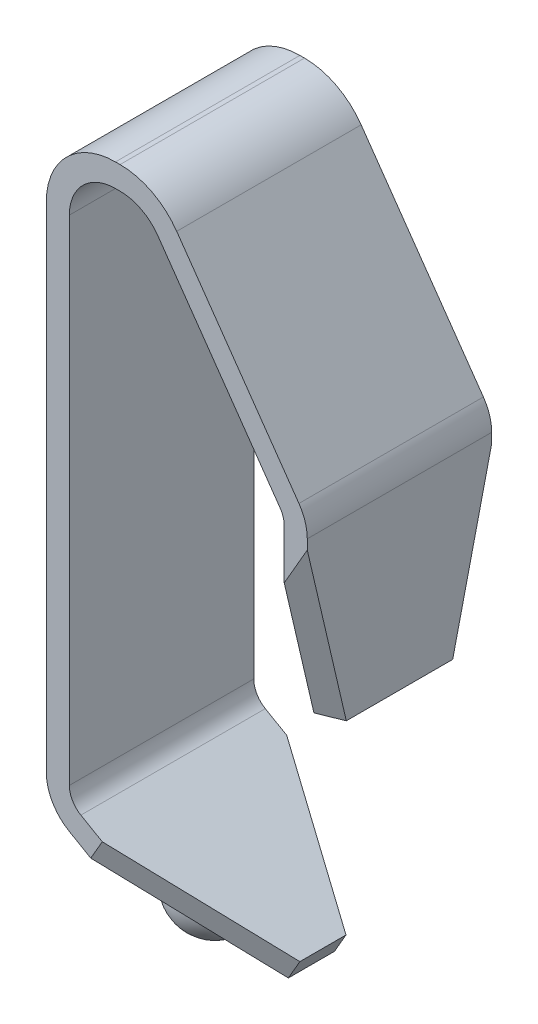
from build123d import *

# Parameters (mm, degrees)
EXTRUDE_THIN1_DEPTH     = 2
CUT_EXTRUDE1_DEPTH      = 14.670442165
CUT_EXTRUDE1_DEPTH_BACK = 14.670442165


with BuildPart() as part:
    # Sketch1 → Extrude-Thin1 (new, symmetric)
    with BuildSketch(Plane.XY):
        with BuildLine():
            Line((3.5, -2.020725942), (0.25, -0.144337567))
            ThreePointArc((0.25, -0.144337567), (0.066987298, 0.038675135), (0, 0.288675135))
            Line((0, 0.288675135), (0, 11))
            ThreePointArc((0, 11), (0.292893219, 11.707106781), (1, 12))
            Line((1, 12), (1.1, 12))
            ThreePointArc((1.1, 12), (1.561748613, 11.887010833), (1.919152044, 11.573576436))
            Line((1.919152044, 11.573576436), (4.570098185, 7.787632989))
            ThreePointArc((4.570098185, 7.787632989), (4.637380639, 7.651197671), (4.660522163, 7.500844771))
            Line((4.660522163, 7.500844771), (4.660522163, 3.658494165))
            Line((4.660522163, 3.658494165), (5.160522163, 3.658494165))
            Line((5.160522163, 3.658494165), (5.160522163, 7.500844771))
            ThreePointArc((5.160522163, 7.500844771), (5.114239114, 7.80155057), (4.979674208, 8.074421207))
            Line((4.979674208, 8.074421207), (2.328728066, 11.860364655))
            ThreePointArc((2.328728066, 11.860364655), (1.79262292, 12.33051625), (1.1, 12.5))
            Line((1.1, 12.5), (1, 12.5))
            ThreePointArc((1, 12.5), (-0.060660172, 12.060660172), (-0.5, 11))
            Line((-0.5, 11), (-0.5, 0.288675135))
            ThreePointArc((-0.5, 0.288675135), (-0.366025404, -0.211324865), (0, -0.577350269))
            Line((0, -0.577350269), (3.25, -2.453738644))
            Line((3.25, -2.453738644), (3.5, -2.020725942))
        make_face()
    extrude(amount=EXTRUDE_THIN1_DEPTH, both=True)

    # Sketch3 → Cut-Extrude1 (cut, two sides: drawn at the far end of the back side and taken through both)
    with BuildSketch(Plane(origin=(0, 0, 0), x_dir=(0.8660254037844364, -0.500000000000004, 0), z_dir=(0.500000000000004, 0.8660254037844364, 0)).offset(-CUT_EXTRUDE1_DEPTH_BACK)):
        Polygon((33.065052182, 13.033927086), (4.041451884, -0.5), (0.824691504, -2), (0.824691504, -2.582001287), (5.059767422, -2.582001287), (5.059767422, 2.96154049), (0.824691504, 2.96154049), (0.824691504, 2), (4.041451884, 0.5), (33.065052182, -13.033927086), (97.113051575, -13.033927086), (97.113051575, 13.033927086), align=None)
    extrude(amount=CUT_EXTRUDE1_DEPTH + CUT_EXTRUDE1_DEPTH_BACK, mode=Mode.SUBTRACT)

    # Sketch6 → Revolve1 (revolve)
    with BuildSketch(Plane.XY):
        with BuildLine():
            Line((1.482050808, -1.433012702), (2.00166605, -1.733012702))
            ThreePointArc((2.00166605, -1.733012702), (1.705049292, -2.662317438), (0.732050808, -2.732050808))
            Line((0.732050808, -2.732050808), (1.482050808, -1.433012702))
        make_face()
    revolve(axis=Axis((1.482050808, -1.433012702, 0), (-0.5000000000000001, -0.8660254037844387, 0)))


solid = part.part
